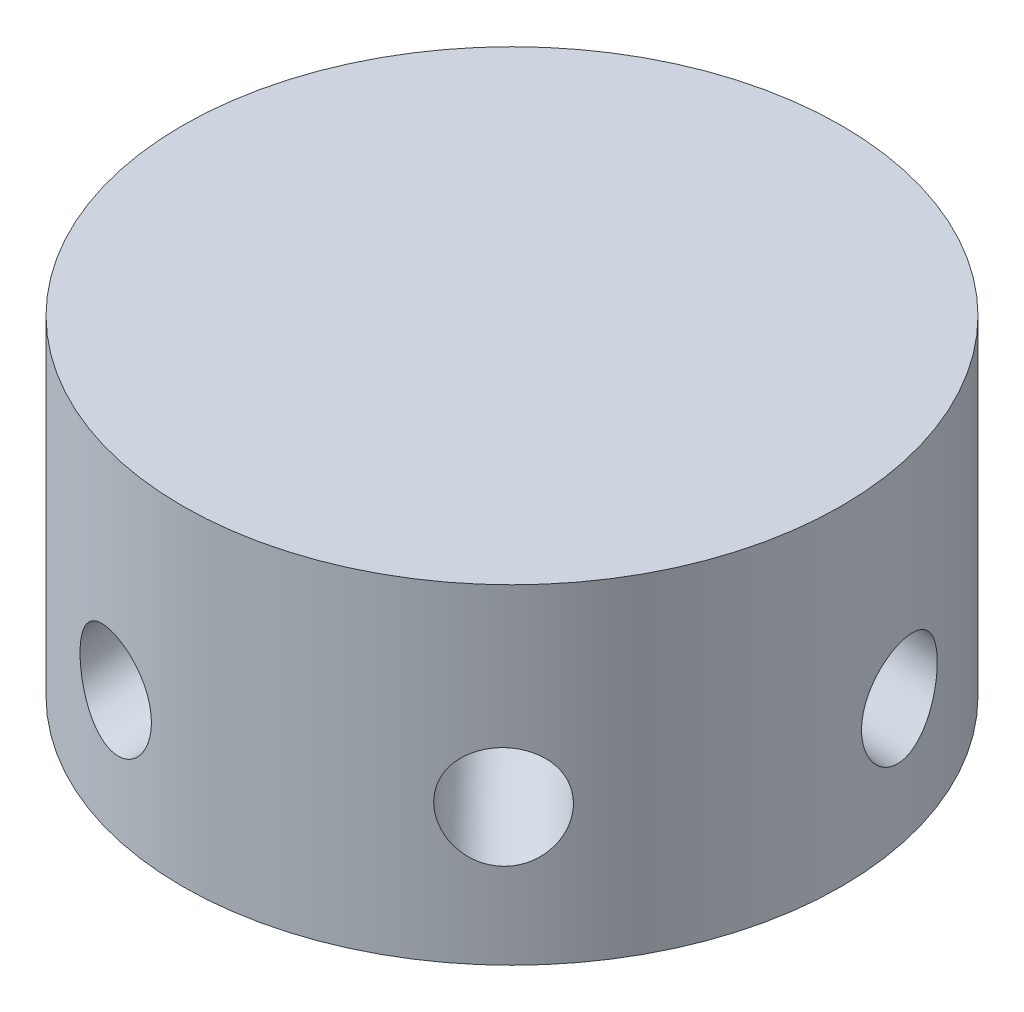
from build123d import *

# Parameters (mm, degrees)
BASE_DEPTH          = 3
BASE_DEPTH_BACK     = 7
SKETCH1_R           = 10
SKETCH2_R           = 1.5
HOLE1_DEPTH         = 19.934353276
HOLE1MIRROR_COUNT   = 2
SKETCH3_R           = 1.5
HOLE2_DEPTH         = 19.445737601
HOLE2MIRROR_COUNT   = 2
SKETCH4_R           = 1.5
HOLE3_DEPTH         = 19.389503466
HOLE3MIRROR_COUNT   = 2
SKETCH5_W           = 1.346153846
SKETCH5_H           = 0.358974359
BOSS_EXTRUDE1_DEPTH = 1


with BuildPart() as part:
    # Sketch1 → base (new, two sides: drawn at the far end of the back side and taken through both)
    with BuildSketch(Plane(origin=(0, 0, 0), x_dir=(1, 0, 0), z_dir=(0, 1, 0)).offset(-BASE_DEPTH_BACK)):
        with Locations(Location((0, 0, 0), (0, 0, 270))):
            Circle(SKETCH1_R)
    extrude(amount=BASE_DEPTH + BASE_DEPTH_BACK)

    # Sketch2 → hole1 (cut, through all)
    with BuildSketch(Plane(origin=(2.670502563, -1.093066116, 2.770130417), x_dir=(-0.6558691872850446, 0.22429081675253856, 0.7207837669443827), z_dir=(-0.6676256406563905, 0.27326652891267483, -0.692532604369038))):
        with Locations(Location((0, 0, 0), (0, 0, 346.516491398))):
            Circle(SKETCH2_R)
    hole1 = extrude(amount=-HOLE1_DEPTH, mode=Mode.SUBTRACT)

    # hole1mirror: hole1 ×2 about axis
    hole1mirror_axis = Axis((0, 5.5, 0), (0, -1, 0))
    for i in range(1, HOLE1MIRROR_COUNT):
        add(hole1.rotate(hole1mirror_axis, i * 360 / HOLE1MIRROR_COUNT), mode=Mode.SUBTRACT)

    # Sketch3 → hole2 (cut, through all)
    with BuildSketch(Plane(origin=(-0.941672921, -1.236067977, 3.685836142), x_dir=(-0.9718935871364875, 0.07382318789513377, -0.22354639834264944), z_dir=(0.23541823021467095, 0.3090169943749464, -0.921459035481267))):
        with Locations(Location((0, 0, 0), (0, 0, 90.062171088))):
            Circle(SKETCH3_R)
    hole2 = extrude(amount=-HOLE2_DEPTH, mode=Mode.SUBTRACT)

    # hole2mirror: hole2 ×2 about axis
    hole2mirror_axis = Axis((0, 5.5, 0), (0, -1, 0))
    for i in range(1, HOLE2MIRROR_COUNT):
        add(hole2.rotate(hole2mirror_axis, i * 360 / HOLE2MIRROR_COUNT), mode=Mode.SUBTRACT)

    # Sketch4 → hole3 (cut, through all)
    with BuildSketch(Plane(origin=(-3.717841, -1.236067977, 0.806098168), x_dir=(-0.19123247894507908, -0.06357892752956036, -0.979483465389136), z_dir=(0.9294602499075393, 0.30901699437494623, -0.20152454200243008))):
        with Locations(Location((0, 0, 0), (0, 0, 90))):
            Circle(SKETCH4_R)
    hole3 = extrude(amount=-HOLE3_DEPTH, mode=Mode.SUBTRACT)

    # hole3mirror: hole3 ×2 about axis
    hole3mirror_axis = Axis((0, 5.5, 0), (0, -1, 0))
    for i in range(1, HOLE3MIRROR_COUNT):
        add(hole3.rotate(hole3mirror_axis, i * 360 / HOLE3MIRROR_COUNT), mode=Mode.SUBTRACT)

    # Sketch5 → Boss-Extrude1 (add)
    # profile 1 of 3: a face of its own
    with BuildSketch(Plane.XZ.offset(7)):
        with BuildLine():
            Line((-1.75, 3.58974359), (-1.508112981, 3.399739583))
            Line((-1.508112981, 3.399739583), (-2.432892628, 1.985576923))
            add(Edge.make_bspline(
                [(-2.432892628, 1.985576923), (-2.371322351, 1.995390784), (-2.251222564, 2.014533829), (-2.129656666, 2.017691774), (-2.07041266, 2.019230769)],
                knots=[0, 0, 0, 0, 1.025318673, 2, 2, 2, 2], degree=3))
            add(Edge.make_bspline(
                [(-2.07041266, 2.019230769), (-2.034840164, 2.018274658), (-1.964816763, 2.01639258), (-1.862009961, 2.001908729), (-1.763221025, 1.979083617), (-1.668859413, 1.945811362), (-1.578586431, 1.903309007), (-1.491884035, 1.852370137), (-1.410382025, 1.790364457), (-1.333030846, 1.721099501), (-1.262803748, 1.644382516), (-1.200627693, 1.56298118), (-1.148400901, 1.476980299), (-1.106026979, 1.386423433), (-1.073122101, 1.291450173), (-1.049134456, 1.192182034), (-1.034954863, 1.088550562), (-1.033029372, 1.018072387), (-1.032051282, 0.982271635)],
                knots=[0, 0, 0, 0, 1.04369286, 2.054478336, 3.041073146, 4.015093852, 4.984733326, 5.965804835, 6.960378782, 7.985147595, 9.009457201, 10.008161701, 10.986880575, 11.956520048, 12.937015923, 13.931873656, 14.949455224, 16, 16, 16, 16], degree=3))
            add(Edge.make_bspline(
                [(-1.032051282, 0.982271635), (-1.033474387, 0.933291931), (-1.036274721, 0.836911465), (-1.064178517, 0.696534758), (-1.107538161, 0.562802243), (-1.16951569, 0.437849071), (-1.246498073, 0.321846502), (-1.340375665, 0.219061036), (-1.447819154, 0.127390999), (-1.569305952, 0.05073438), (-1.700048916, -0.011868671), (-1.837400913, -0.056833913), (-1.98002806, -0.084517383), (-2.076832668, -0.087987985), (-2.125801282, -0.08974359)],
                knots=[0, 0, 0, 0, 1.031375318, 2.029502543, 3.004789286, 3.987476834, 4.960371455, 5.9300674, 6.912260825, 7.929083631, 8.949397511, 9.960523116, 10.96833055, 12, 12, 12, 12], degree=3))
            add(Edge.make_bspline(
                [(-2.125801282, -0.08974359), (-2.172897983, -0.088215384), (-2.266188301, -0.085188276), (-2.403421095, -0.058222338), (-2.535284112, -0.014515235), (-2.660853493, 0.045699043), (-2.777174106, 0.121756926), (-2.881239743, 0.213319205), (-2.972531517, 0.31842867), (-3.048506138, 0.437069018), (-3.10876487, 0.564558975), (-3.153954795, 0.697496132), (-3.180351038, 0.835396113), (-3.184039595, 0.928877252), (-3.185897436, 0.975961538)],
                knots=[0, 0, 0, 0, 1.012016664, 2.004627821, 2.994792927, 3.992885782, 4.990978636, 5.973936114, 6.964471063, 7.975201453, 8.993600317, 9.990122807, 10.98767138, 12, 12, 12, 12], degree=3))
            add(Edge.make_bspline(
                [(-3.185897436, 0.975961538), (-3.184715991, 1.012006122), (-3.182303706, 1.085602274), (-3.165460316, 1.197066302), (-3.138395521, 1.311117383), (-3.108085274, 1.407871577), (-3.076059664, 1.487133099), (-3.049407125, 1.55103659), (-3.016233129, 1.616797663), (-2.980859748, 1.686671299), (-2.940102879, 1.758856731), (-2.895787229, 1.834560401), (-2.846687578, 1.912578329), (-2.812267416, 1.965522524), (-2.794671474, 1.992588141)],
                knots=[0, 0, 0, 0, 1.173818275, 2.396712641, 3.66331629, 4.989737886, 5.693666774, 6.447286557, 7.243889047, 8.091586357, 8.998013824, 9.943181721, 10.948533338, 12, 12, 12, 12], degree=3))
            Line((-2.794671474, 1.992588141), (-1.75, 3.58974359))
        make_face()
        with BuildLine():
            add(Edge.make_bspline(
                [(-2.136318109, 1.66025641), (-2.162980354, 1.659478367), (-2.215059463, 1.657958621), (-2.291466878, 1.649133369), (-2.363780129, 1.632514304), (-2.432957263, 1.611347972), (-2.497704966, 1.582244912), (-2.558493806, 1.546893113), (-2.615558858, 1.505271935), (-2.668302409, 1.457971024), (-2.716122073, 1.406182991), (-2.757303204, 1.350713469), (-2.792825604, 1.292899266), (-2.821707422, 1.232257323), (-2.844197498, 1.168810824), (-2.860465749, 1.102851574), (-2.8695195, 1.033937268), (-2.871025732, 0.987204766), (-2.871794872, 0.963341346)],
                knots=[0, 0, 0, 0, 1.129588631, 2.206414736, 3.251139165, 4.268635594, 5.265702196, 6.250456724, 7.242448911, 8.251968645, 9.246821453, 10.222880186, 11.173611482, 12.116736599, 13.062300278, 14.020270554, 14.989073742, 16, 16, 16, 16], degree=3))
            add(Edge.make_bspline(
                [(-2.871794872, 0.963341346), (-2.87116851, 0.939691366), (-2.869940309, 0.893317277), (-2.858787989, 0.824978097), (-2.841752907, 0.759213189), (-2.816412511, 0.69636159), (-2.786185622, 0.635465272), (-2.746280298, 0.578729986), (-2.702063512, 0.522709916), (-2.649209579, 0.471708445), (-2.592486216, 0.424251821), (-2.531885014, 0.382771567), (-2.468725054, 0.347285394), (-2.402153632, 0.319474296), (-2.333115248, 0.296650009), (-2.261034694, 0.28058853), (-2.185861838, 0.271508004), (-2.1349399, 0.26999981), (-2.108974359, 0.269230769)],
                knots=[0, 0, 0, 0, 0.989467248, 1.94019797, 2.891935182, 3.827694429, 4.772920941, 5.730924762, 6.725747692, 7.756678648, 8.79901574, 9.819492441, 10.826891316, 11.826466727, 12.835195252, 13.867842842, 14.912794438, 16, 16, 16, 16], degree=3))
            add(Edge.make_bspline(
                [(-2.108974359, 0.269230769), (-2.08300886, 0.269999871), (-2.032087006, 0.271508182), (-1.956913546, 0.280587851), (-1.884835227, 0.296652499), (-1.815788718, 0.31946527), (-1.749247287, 0.347318879), (-1.686142566, 0.382550799), (-1.626114472, 0.424506917), (-1.569353873, 0.471627345), (-1.516719934, 0.523000197), (-1.471442656, 0.578229919), (-1.432759422, 0.635923815), (-1.401325235, 0.696121704), (-1.376263944, 0.759251192), (-1.359142477, 0.824967916), (-1.348013188, 0.893319942), (-1.346781822, 0.939692266), (-1.346153846, 0.963341346)],
                knots=[0, 0, 0, 0, 1.087397944, 2.132534446, 3.165364764, 4.174271784, 5.174024072, 6.181601208, 7.194203697, 8.236725232, 9.267838612, 10.269026844, 11.221737037, 12.171628256, 13.107553087, 14.05945871, 15.010357665, 16, 16, 16, 16], degree=3))
            add(Edge.make_bspline(
                [(-1.346153846, 0.963341346), (-1.346704139, 0.987235897), (-1.347784185, 1.03413313), (-1.360000134, 1.102820748), (-1.376942508, 1.169145954), (-1.402525538, 1.232691903), (-1.435762083, 1.29320783), (-1.47624549, 1.350999431), (-1.523078061, 1.406509779), (-1.5771756, 1.458072587), (-1.636065834, 1.505219665), (-1.698681419, 1.546839221), (-1.764189393, 1.581964198), (-1.832523336, 1.6112713), (-1.904466218, 1.632420774), (-1.978856557, 1.649074017), (-2.0566458, 1.657936035), (-2.109422408, 1.6594731), (-2.136318109, 1.66025641)],
                knots=[0, 0, 0, 0, 0.978206639, 1.919901502, 2.851605144, 3.780102724, 4.718870031, 5.675451981, 6.667674623, 7.690630536, 8.733308323, 9.756129687, 10.767539656, 11.776269907, 12.797430371, 13.836405707, 14.897401972, 16, 16, 16, 16], degree=3))
        make_face(mode=Mode.SUBTRACT)
    # profile 2 of 3: a face of its own
    with BuildSketch(Plane.XZ.offset(7)):
        with Locations((0, 1.346153847)):
            Rectangle(SKETCH5_W, SKETCH5_H)
    # profile 3 of 3: a face of its own
    with BuildSketch(Plane.XZ.offset(7)):
        Polygon((1.686197917, 3.5), (2.333333333, 3.5), (2.333333333, 0), (2.019230769, 0), (2.019230769, 3.141025641), (1.480769231, 3.141025641), align=None)
    extrude(amount=BOSS_EXTRUDE1_DEPTH)


solid = part.part
